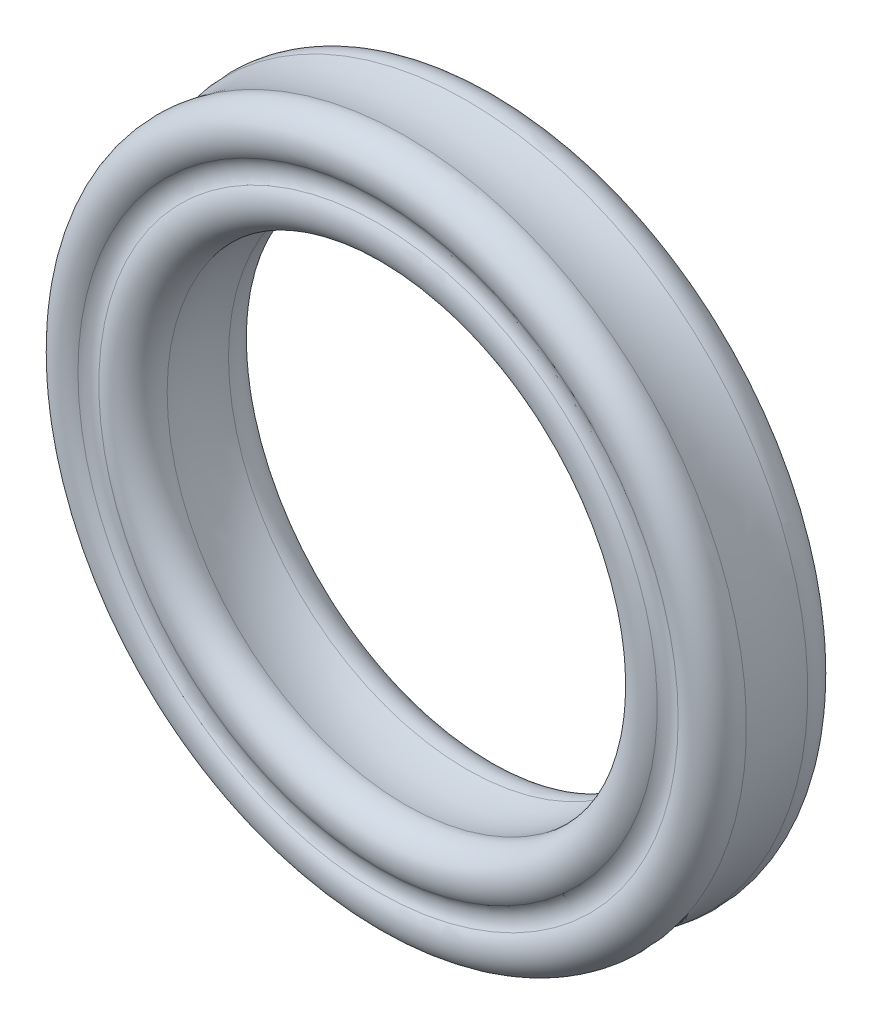
from build123d import *


with BuildPart() as part:
    # Esquisse1 → Base-Révolution (revolve)
    with BuildSketch(Plane(origin=(0, 0, 0), x_dir=(0, 0, -1), z_dir=(1, 0, 0))):
        with BuildLine():
            ThreePointArc((0.745714286, 7.832037238), (0.100204768, 7.581970971), (0.12, 6.89))
            ThreePointArc((0.12, 6.89), (0.2, 6.65), (0.12, 6.41))
            ThreePointArc((0.12, 6.41), (0.100204768, 5.718029029), (0.745714286, 5.467962762))
            ThreePointArc((0.745714286, 5.467962762), (1.45, 5.554782776), (2.154285714, 5.467962762))
            ThreePointArc((2.154285714, 5.467962762), (2.799795232, 5.718029029), (2.78, 6.41))
            ThreePointArc((2.78, 6.41), (2.7, 6.65), (2.78, 6.89))
            ThreePointArc((2.78, 6.89), (2.799795232, 7.581970971), (2.154285714, 7.832037238))
            ThreePointArc((2.154285714, 7.832037238), (1.45, 7.745217224), (0.745714286, 7.832037238))
        make_face()
    revolve(axis=Axis((0, 0, 0), (0, 0, -1)))


solid = part.part
